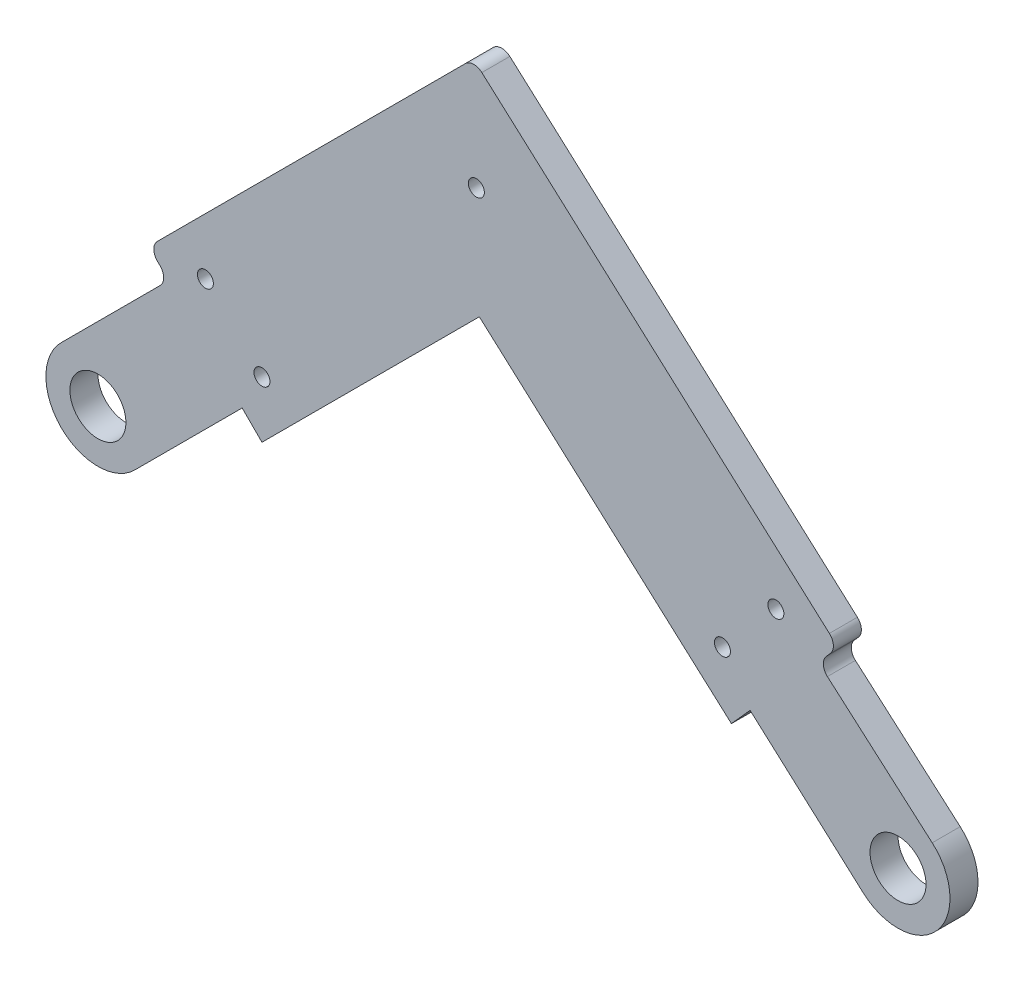
from build123d import *

# Parameters (mm, degrees)
SKETCH6_R           = 1
SKETCH6_R_2         = 3.5
BOSS_EXTRUDE2_DEPTH = 3.5
FILLET1_R           = 1.5


with BuildPart() as part:
    # Sketch6 → Boss-Extrude2 (new body)
    with BuildSketch(Plane.XY):
        with BuildLine():
            Line((-18.481457554, 7.854026145), (-4.341757745, -4.837265724))
            ThreePointArc((-4.341757745, -4.837265724), (4.866357239, -4.309126039), (4.276299413, 4.895228629))
            Line((4.276299413, 4.895228629), (-9.968273897, 17.338786449))
            Line((-9.968273897, 17.338786449), (-7.460072509, 20.133239137))
            Line((-7.460072509, 20.133239137), (-53.070551784, 61.07158384))
            Line((-53.070551784, 61.07158384), (-93.636038969, 20.506096654))
            Line((-93.636038969, 20.506096654), (-91.161165235, 18.03122292))
            Line((-91.161165235, 18.03122292), (-104.596194078, 4.596194078))
            ThreePointArc((-104.596194078, 4.596194078), (-104.596194078, -4.596194078), (-95.403805922, -4.596194078))
            Line((-95.403805922, -4.596194078), (-81.96877708, 8.838834765))
            Line((-81.96877708, 8.838834765), (-79.493903346, 6.363961031))
            Line((-79.493903346, 6.363961031), (-52.327712868, 33.530151508))
            Line((-52.327712868, 33.530151508), (-20.819327109, 5.249344602))
            Line((-20.819327109, 5.249344602), (-18.481457554, 7.854026145))
        make_face()
        with Locations((-52.699132326, 47.300867674)):
            Circle(SKETCH6_R, mode=Mode.SUBTRACT)
        Circle(SKETCH6_R_2, mode=Mode.SUBTRACT)
        with Locations((-100, 0)):
            Circle(SKETCH6_R_2, mode=Mode.SUBTRACT)
        with Locations((-86.564971157, 20.506096654)):
            Circle(SKETCH6_R, mode=Mode.SUBTRACT)
        with Locations((-15.26505452, 20.420041883)):
            Circle(SKETCH6_R, mode=Mode.SUBTRACT)
        with Locations((-21.944681819, 12.978094615)):
            Circle(SKETCH6_R, mode=Mode.SUBTRACT)
        with Locations((-79.493903346, 13.435028843)):
            Circle(SKETCH6_R, mode=Mode.SUBTRACT)
    extrude(amount=BOSS_EXTRUDE2_DEPTH)

    # Fillet1
    fillet1_edges = [part.edges().sort_by_distance(p)[0] for p in [
        (-91.161165235, 18.03122292, 1.75),
        (-93.636038969, 20.506096654, 1.75),
        (-53.070551784, 61.07158384, 1.75),
        (-7.460072509, 20.133239137, 1.75),
        (-9.968273897, 17.338786449, 1.75),
    ]]
    fillet(fillet1_edges, radius=FILLET1_R)


solid = part.part
